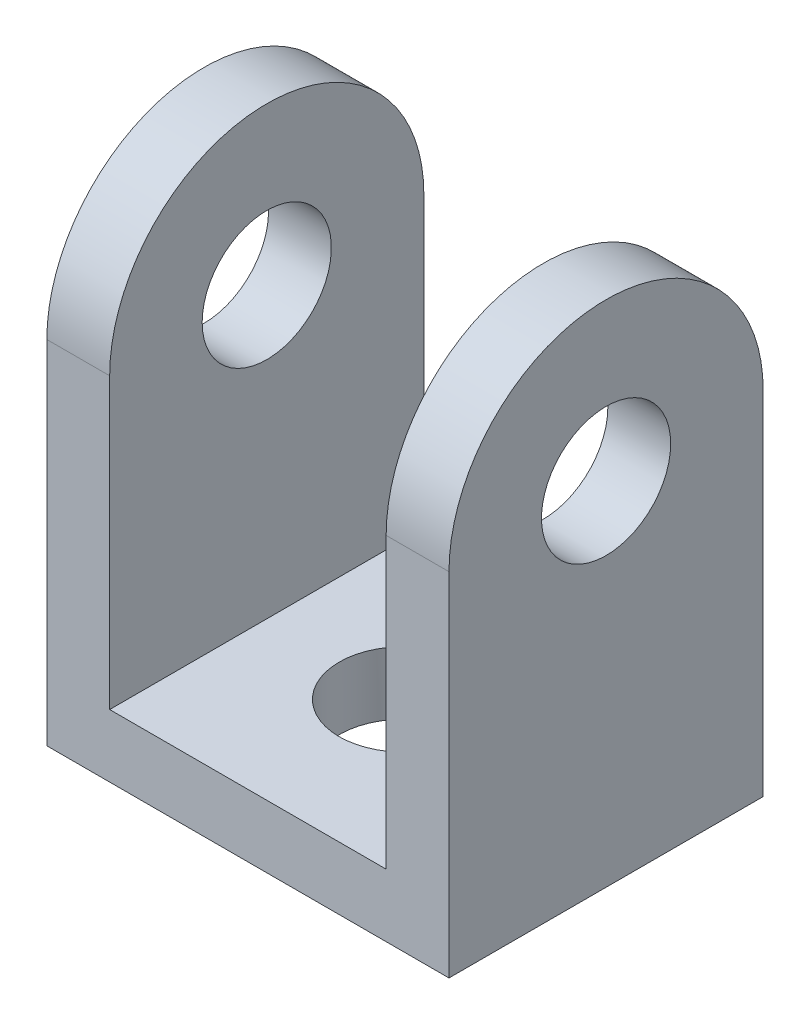
from build123d import *

# Parameters (mm, degrees)
SKETCH2_R           = 7.9375
SKETCH2_R_2         = 3.2639
BOSS_EXTRUDE1_DEPTH = 20.32
SKETCH3_W           = 13.97
SKETCH3_H           = 25.4
CUT_EXTRUDE1_DEPTH  = 12.7
SKETCH4_R           = 3.2639
CUT_EXTRUDE2_DEPTH  = 29.143111169


with BuildPart() as part:
    # Sketch2 → Boss-Extrude1 (new body)
    # profile 1 of 2: a face of its own
    with BuildSketch(Plane(origin=(0, 0, 0), x_dir=(0, 0, -1), z_dir=(1, 0, 0))):
        with BuildLine():
            ThreePointArc((7.9375, 0), (0, -7.9375), (-7.9375, 0))
            Line((-7.9375, 0), (-7.9375, -17.78))
            Line((-7.9375, -17.78), (7.9375, -17.78))
            Line((7.9375, -17.78), (7.9375, 0))
        make_face()
    # profile 2 of 2: a face of its own
    with BuildSketch(Plane(origin=(0, 0, 0), x_dir=(0, 0, -1), z_dir=(1, 0, 0))):
        Circle(SKETCH2_R)
        Circle(SKETCH2_R_2, mode=Mode.SUBTRACT)
    extrude(amount=BOSS_EXTRUDE1_DEPTH)

    # Sketch3 → Cut-Extrude1 (cut, symmetric)
    with BuildSketch(Plane.XY):
        with Locations((10.16, -1.905)):
            Rectangle(SKETCH3_W, SKETCH3_H)
    extrude(amount=CUT_EXTRUDE1_DEPTH, both=True, mode=Mode.SUBTRACT)

    # Sketch4 → Cut-Extrude2 (cut, through all)
    with BuildSketch(Plane(origin=(0, 0, 0), x_dir=(1, 0, 0), z_dir=(0, 1, 0))):
        with Locations(Location((10.16, -0.0635, 0), (0, 0, 270))):
            Circle(SKETCH4_R)
    extrude(amount=-CUT_EXTRUDE2_DEPTH, mode=Mode.SUBTRACT)


solid = part.part
